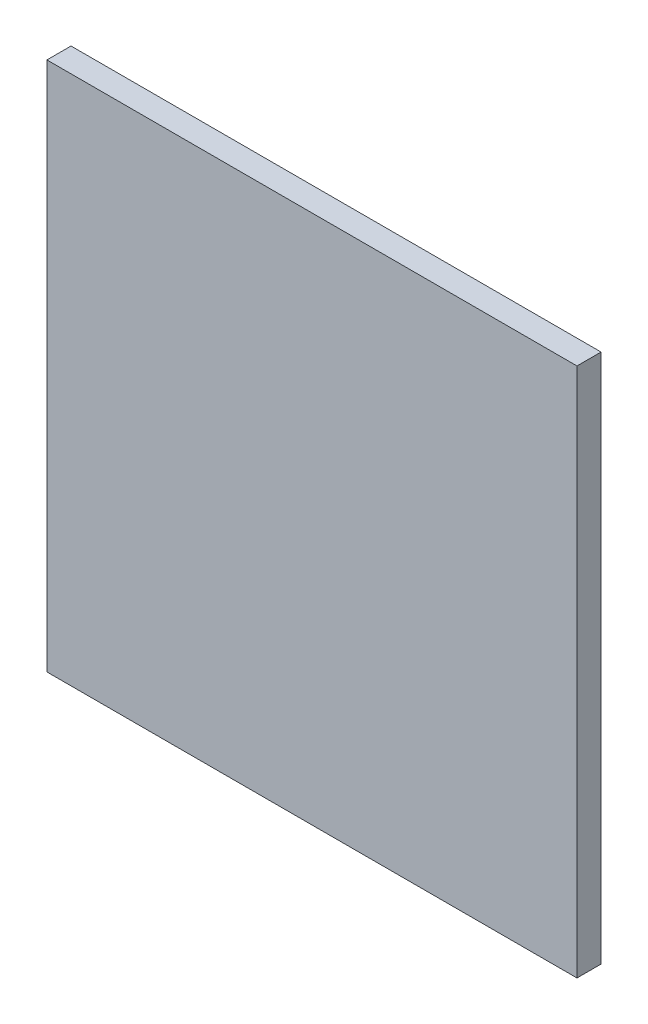
from build123d import *

# Parameters (mm, degrees)
SKETCH_1_W      = 110
SKETCH_1_H      = 110
EXTRUDE_1_DEPTH = 2.5


with BuildPart() as part:
    # Эскиз1 → Бобышка-Вытянуть1 (new, symmetric)
    with BuildSketch(Plane.XY):
        Rectangle(SKETCH_1_W, SKETCH_1_H)
    extrude(amount=EXTRUDE_1_DEPTH, both=True)


solid = part.part
